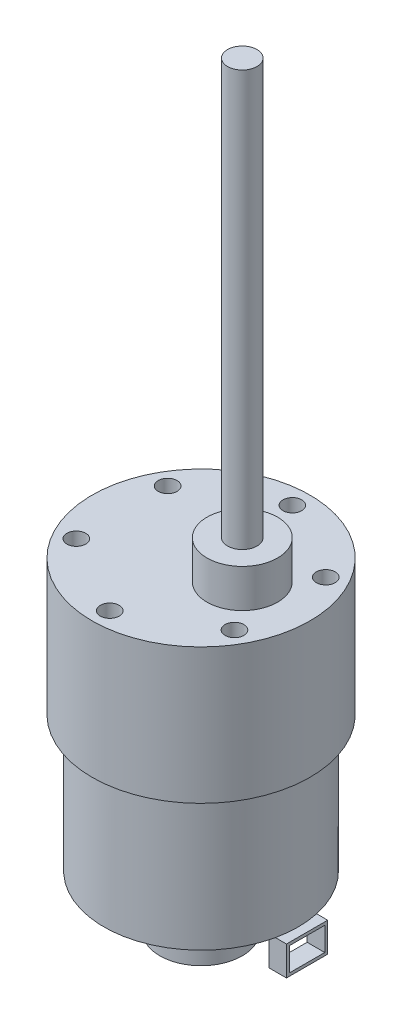
from build123d import *

# Parameters (mm, degrees)
SKETCH_1_R          = 16.5
EXTRUDE_1_DEPTH     = 46
SKETCH_2_R          = 7
EXTRUDE_2_DEPTH     = 9
SKETCH_3_W          = 3
SKETCH_3_H          = 7
EXTRUDE_3_DEPTH     = 5
SKETCH_4_W          = 6
SKETCH_4_H          = 4
CUT_EXTRUDE_1_DEPTH = 3
SKETCH_5_R          = 6
EXTRUDE_4_DEPTH     = 6.5
SKETCH_7_R          = 2.5
EXTRUDE_5_DEPTH     = 70.5
EXTRUDE_START       = -23
SKETCH_8_R          = 18.5
SKETCH_8_R_2        = 16.5
EXTRUDE_6_DEPTH     = 23
SKETCH_9_R          = 1.6
CUT_EXTRUDE_2_DEPTH = 10


with BuildPart() as part:
    # 草图1 → 凸台-拉伸1 (new body)
    with BuildSketch(Plane(origin=(0, 0, 0), x_dir=(1, 0, 0), z_dir=(0, 1, 0))):
        with Locations(Location((0, 0, 0), (0, 0, 270))):
            Circle(SKETCH_1_R)
    extrude(amount=EXTRUDE_1_DEPTH)

    # 草图2 → 凸台-拉伸2 (add)
    with BuildSketch(Plane.XZ):
        with Locations(Location((0, 0, 0), (0, 0, 90))):
            Circle(SKETCH_2_R)
    extrude(amount=EXTRUDE_2_DEPTH)

    # 草图3 → 凸台-拉伸3 (add)
    with BuildSketch(Plane.XZ):
        with Locations((16.5, 0)):
            Rectangle(SKETCH_3_W, SKETCH_3_H)
    extrude(amount=EXTRUDE_3_DEPTH)

    # 草图4 → 切除-拉伸1 (cut)
    with BuildSketch(Plane(origin=(18, 0, 0), x_dir=(0, 0, -1), z_dir=(1, 0, 0))):
        with Locations((0, -2.5)):
            Rectangle(SKETCH_4_W, SKETCH_4_H)
    extrude(amount=-CUT_EXTRUDE_1_DEPTH, mode=Mode.SUBTRACT)

    # 草图5 → 凸台-拉伸4 (add)
    with BuildSketch(Plane(origin=(0, 46, 0), x_dir=(1, 0, 0), z_dir=(0, 1, 0))):
        with Locations(Location((7, 0, 0), (0, 0, 90))):
            Circle(SKETCH_5_R)
    extrude(amount=EXTRUDE_4_DEPTH)

    # 草图7 → 凸台-拉伸5 (add)
    with BuildSketch(Plane(origin=(0, 52.5, 0), x_dir=(1, 0, 0), z_dir=(0, 1, 0))):
        with Locations(Location((7, 0, 0), (0, 0, 270))):
            Circle(SKETCH_7_R)
    extrude(amount=EXTRUDE_5_DEPTH)

    # 草图8 → 凸台-拉伸6 (add)
    with BuildSketch(Plane(origin=(0, 46, 0), x_dir=(1, 0, 0), z_dir=(0, 1, 0)).offset(EXTRUDE_START)):
        with Locations(Location((0, 0, 0), (0, 0, 270))):
            Circle(SKETCH_8_R)
        with Locations(Location((0, 0, 0), (0, 0, 12.246689727))):
            Circle(SKETCH_8_R_2, mode=Mode.SUBTRACT)
    extrude(amount=EXTRUDE_6_DEPTH)

    # 草图9 → 切除-拉伸2 (cut)
    with BuildSketch(Plane(origin=(0, 46, 0), x_dir=(1, 0, 0), z_dir=(0, 1, 0))):
        with Locations(Location((-13.423393759, 7.75, 0), (0, 0, 270))):
            Circle(SKETCH_9_R)
        with Locations(Location((0, 15.5, 0), (0, 0, 270))):
            Circle(SKETCH_9_R)
        with Locations(Location((13.423393759, 7.75, 0), (0, 0, 270))):
            Circle(SKETCH_9_R)
        with Locations(Location((13.423393759, -7.75, 0), (0, 0, 270))):
            Circle(SKETCH_9_R)
        with Locations(Location((0, -15.5, 0), (0, 0, 270))):
            Circle(SKETCH_9_R)
        with Locations(Location((-13.423393759, -7.75, 0), (0, 0, 270))):
            Circle(SKETCH_9_R)
    extrude(amount=-CUT_EXTRUDE_2_DEPTH, mode=Mode.SUBTRACT)


solid = part.part
